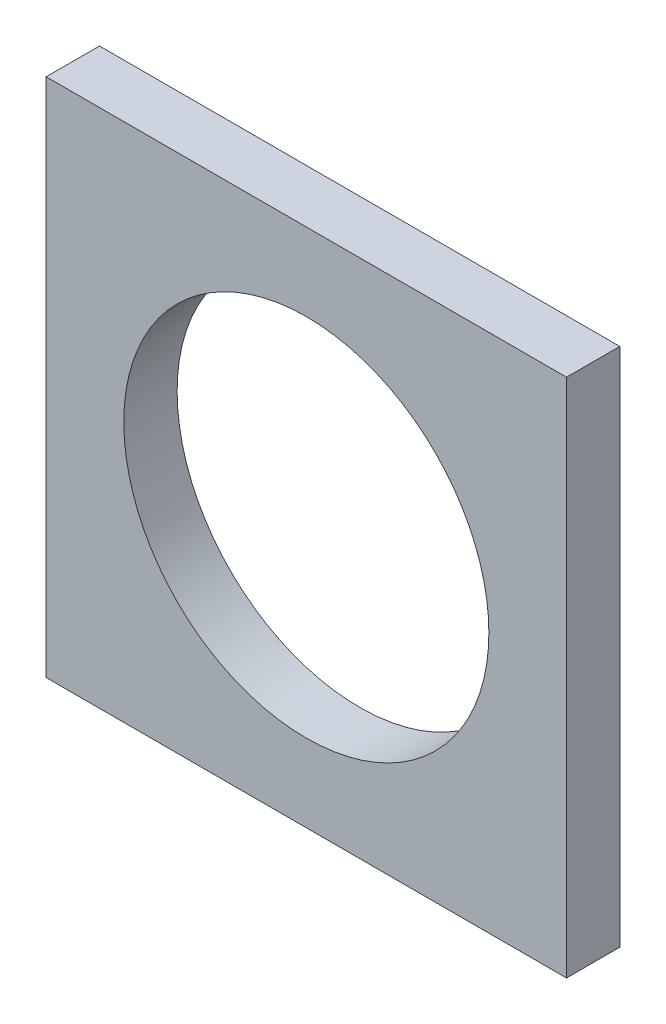
from build123d import *

# Parameters (mm, degrees)
SKETCH1_W           = 30.988
SKETCH1_H           = 30.988
SKETCH1_R           = 5.7277
BOSS_EXTRUDE1_DEPTH = 3.175
SKETCH2_R           = 10.8712
CUT_EXTRUDE2_DEPTH  = 3.2512


with BuildPart() as part:
    # Sketch1 → Boss-Extrude1 (new body)
    with BuildSketch(Plane.XY):
        with Locations((15.494, 15.494)):
            Rectangle(SKETCH1_W, SKETCH1_H)
        with Locations((15.494, 15.494)):
            Circle(SKETCH1_R, mode=Mode.SUBTRACT)
    extrude(amount=BOSS_EXTRUDE1_DEPTH)

    # Sketch2 → Cut-Extrude2 (cut)
    with BuildSketch(Plane(origin=(0, 0, 0), x_dir=(-1, 0, 0), z_dir=(0, 0, -1))):
        with Locations((-15.494, 15.494)):
            Circle(SKETCH2_R)
    extrude(amount=-CUT_EXTRUDE2_DEPTH, mode=Mode.SUBTRACT)


solid = part.part
